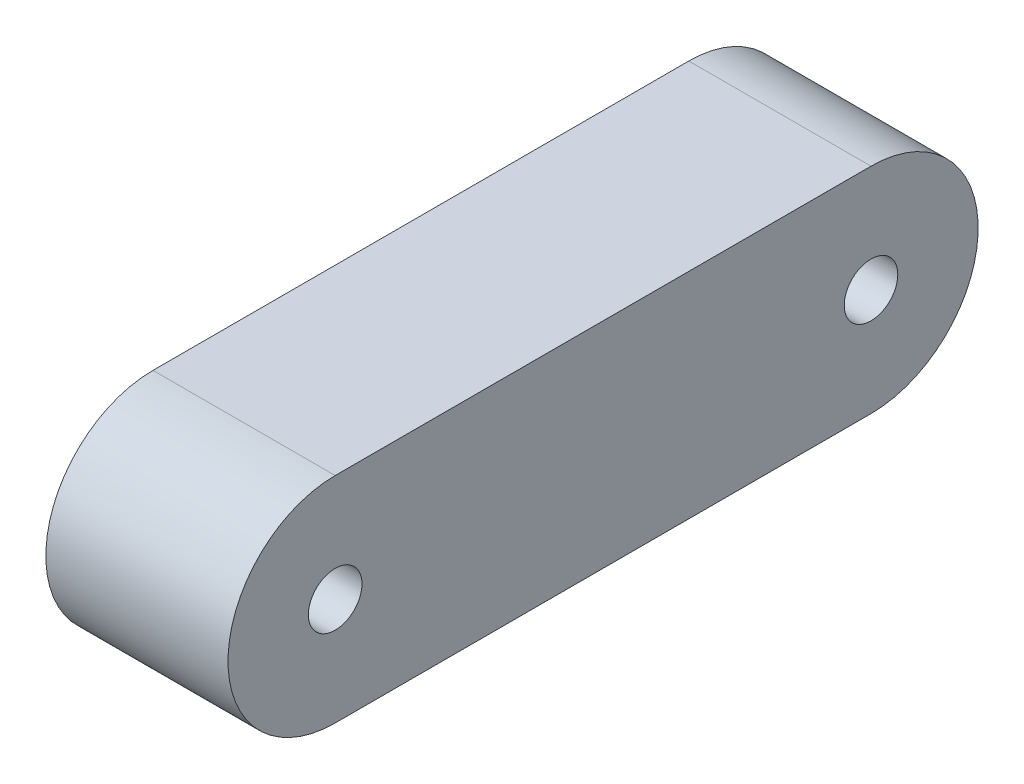
from build123d import *

# Parameters (mm, degrees)
CROQUIS1_R              = 2.5
SALIENTE_EXTRUIR1_DEPTH = 8.5


with BuildPart() as part:
    # Croquis1 → Saliente-Extruir1 (new, symmetric)
    with BuildSketch(Plane(origin=(0, 0, 0), x_dir=(0, 0, -1), z_dir=(1, 0, 0))):
        with BuildLine():
            Line((-25, 10), (25, 10))
            ThreePointArc((25, 10), (35, 0), (25, -10))
            Line((25, -10), (-25, -10))
            ThreePointArc((-25, -10), (-35, 0), (-25, 10))
        make_face()
        with Locations((-25, 0)):
            Circle(CROQUIS1_R, mode=Mode.SUBTRACT)
        with Locations((25, 0)):
            Circle(CROQUIS1_R, mode=Mode.SUBTRACT)
    extrude(amount=SALIENTE_EXTRUIR1_DEPTH, both=True)


solid = part.part
